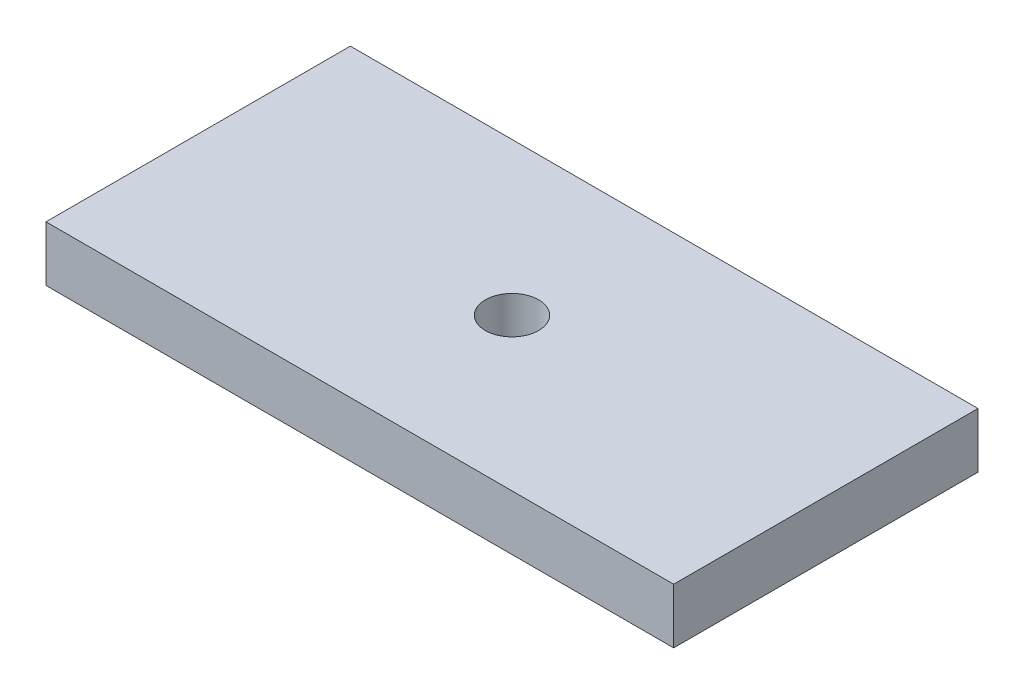
from build123d import *

# Parameters (mm, degrees)
SKETCH1_W           = 16.5
SKETCH1_H           = 8
SKETCH1_R           = 0.70072694
BOSS_EXTRUDE1_DEPTH = 1.45


with BuildPart() as part:
    # Sketch1 → Boss-Extrude1 (new body)
    with BuildSketch(Plane(origin=(0, 0, 0), x_dir=(1, 0, 0), z_dir=(0, 1, 0))):
        Rectangle(SKETCH1_W, SKETCH1_H)
        with Locations(Location((0, 0, 0), (0, 0, 270))):
            Circle(SKETCH1_R, mode=Mode.SUBTRACT)
    extrude(amount=BOSS_EXTRUDE1_DEPTH)


solid = part.part
